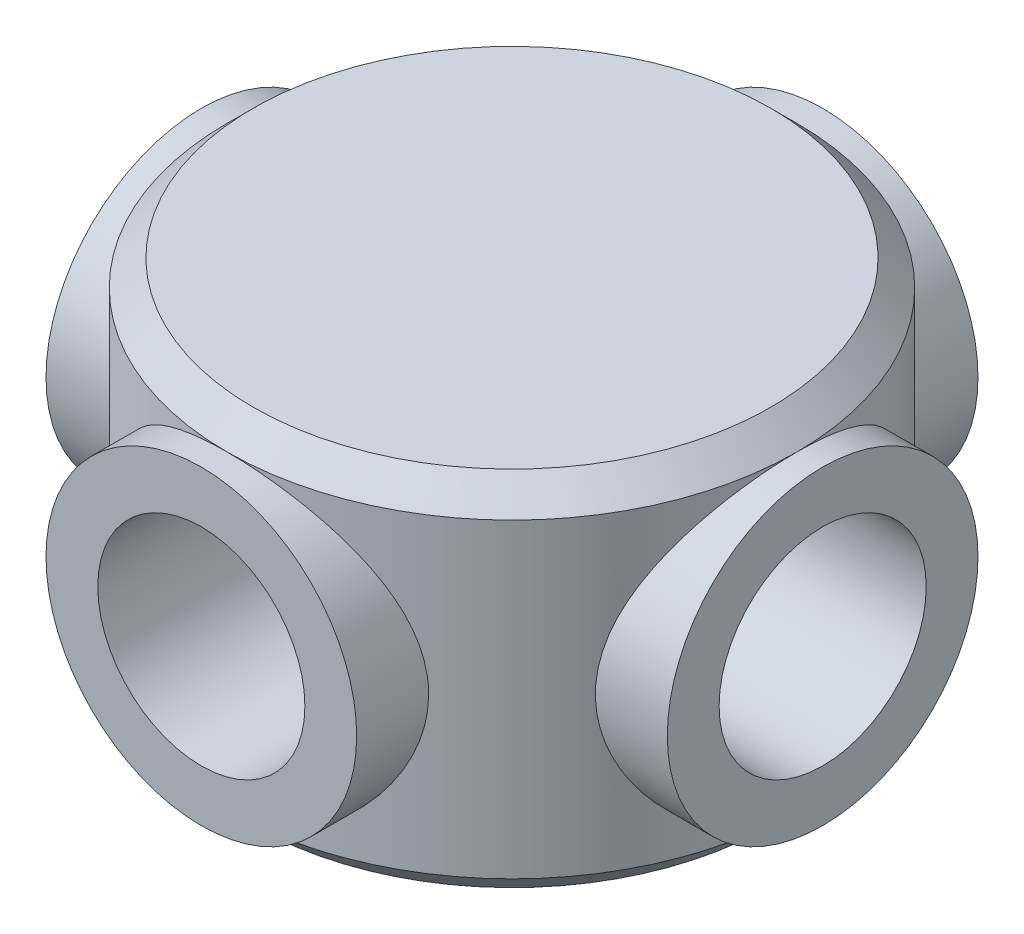
from build123d import *
from build123d.topology import SkipClean

# Parameters (mm, degrees)
CROQUIS1_W                   = 11
CROQUIS1_H                   = 14
CHAFL_N1_SIZE                = 1
SALIENTE_EXTRUIR1_REACH      = 31.086
SALIENTE_EXTRUIR1_END_RADIUS = 11
CROQUIS2_R                   = 6
MATRIZC1_COUNT               = 4
MATRIZC4_COUNT               = 4


with BuildPart() as part:
    # Croquis1 → Revolución1 (revolve)
    with BuildSketch(Plane(origin=(0, 0, 0), x_dir=(0, 0, -1), z_dir=(1, 0, 0))):
        with Locations((5.5, 7)):
            Rectangle(CROQUIS1_W, CROQUIS1_H)
    revolve(axis=Axis((0, 0, 0), (0, 1, 0)))

    # Chaflán1
    chafl_n1_edges = [part.edges().sort_by_distance(p)[0] for p in [
        (0, 0, 11),
        (0, 14, 11),
    ]]
    chamfer(chafl_n1_edges, length=CHAFL_N1_SIZE)

    # Saliente-Extruir1: up to this cylinder (the profile starts outside it)
    with SkipClean():  # the faces are left unmerged after this step: merging them gives an invalid solid
        saliente_extruir1_end = Plane(origin=(0, 7, 0), z_dir=(0, -1, 0)) * Cylinder(SALIENTE_EXTRUIR1_END_RADIUS, 85.172, mode=Mode.PRIVATE)
        # Croquis2 → Saliente-Extruir1 (add, up to the surface)
        with BuildSketch(Plane.XY.offset(12), mode=Mode.PRIVATE) as saliente_extruir1_sk1:
            with Locations((0, 7)):
                Circle(CROQUIS2_R)
        saliente_extruir1_tool1 = extrude(saliente_extruir1_sk1.sketch, amount=-SALIENTE_EXTRUIR1_REACH, mode=Mode.PRIVATE) - saliente_extruir1_end
        saliente_extruir1 = saliente_extruir1_tool1.solids().sort_by_distance((0, 7, 12))[0]
        add(saliente_extruir1)

    # MatrizC1: Saliente-Extruir1 ×4 about axis
    matrizc1_axis = Axis((0, 0, 0), (0, 1, 0))
    for i in range(1, MATRIZC1_COUNT):
        add(saliente_extruir1.rotate(matrizc1_axis, i * 360 / MATRIZC1_COUNT))

    # Croquis4 → Cortar-Revolución1 (revolve, cut)
    with BuildSketch(Plane.XY):
        Polygon((3.5, 7), (12, 7), (12, 3), (5, 3), align=None)
    cortar_revoluci_n1 = revolve(axis=Axis((3.5, 7, 0), (1, 0, 0)), mode=Mode.SUBTRACT)

    # MatrizC4: Cortar-Revolución1 ×4 about axis
    matrizc4_axis = Axis((0, 14, 0), (0, 1, 0))
    for i in range(1, MATRIZC4_COUNT):
        add(cortar_revoluci_n1.rotate(matrizc4_axis, i * 360 / MATRIZC4_COUNT), mode=Mode.SUBTRACT)


solid = part.part
